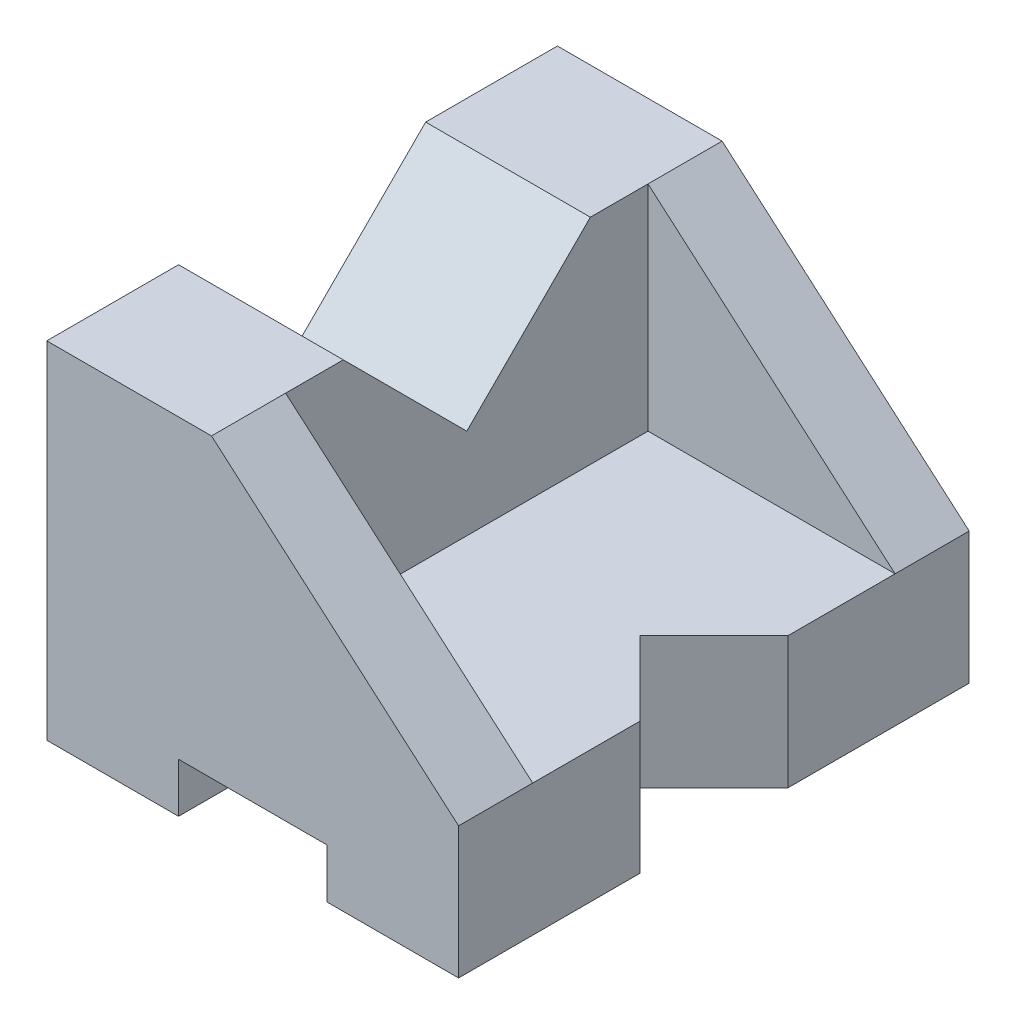
from build123d import *

# Parameters (mm, degrees)
BOSS_EXTRUDE1_DEPTH = 31
BOSS_EXTRUDE2_START = 22
BOSS_EXTRUDE2_DEPTH = 9
BOSS_EXTRUDE3_START = -22
BOSS_EXTRUDE3_DEPTH = 9
CUT_EXTRUDE1_DEPTH  = 39
CUT_EXTRUDE2_DEPTH  = 39


with BuildPart() as part:
    # Sketch1 → Boss-Extrude1 (new, symmetric)
    with BuildSketch(Plane.XY):
        Polygon((20, 42), (0, 42), (0, 0), (16, 0), (16, 6), (34, 6), (34, 0), (50, 0), (50, 16), (20, 16), align=None)
    extrude(amount=BOSS_EXTRUDE1_DEPTH, both=True)

    # Sketch1<3> → Boss-Extrude2 (add)
    with BuildSketch(Plane.XY.offset(BOSS_EXTRUDE2_START)):
        Polygon((50, 16), (20, 42), (20, 16), align=None)
    extrude(amount=BOSS_EXTRUDE2_DEPTH)

    # Sketch1<5> → Boss-Extrude3 (add)
    with BuildSketch(Plane.XY.offset(BOSS_EXTRUDE3_START)):
        Polygon((50, 16), (20, 42), (20, 16), align=None)
    extrude(amount=-BOSS_EXTRUDE3_DEPTH)

    # Sketch3 → Cut-Extrude1 (cut)
    with BuildSketch(Plane(origin=(20, 0, 0), x_dir=(0, 0, -1), z_dir=(1, 0, 0))):
        Polygon((-15, 42), (0, 27), (15, 42), align=None)
    extrude(amount=-CUT_EXTRUDE1_DEPTH, mode=Mode.SUBTRACT)

    # Sketch4 → Cut-Extrude2 (cut)
    with BuildSketch(Plane(origin=(0, 16, 0), x_dir=(1, 0, 0), z_dir=(0, 1, 0))):
        Polygon((50, 9), (41, 0), (50, -9), align=None)
    extrude(amount=-CUT_EXTRUDE2_DEPTH, mode=Mode.SUBTRACT)


solid = part.part
